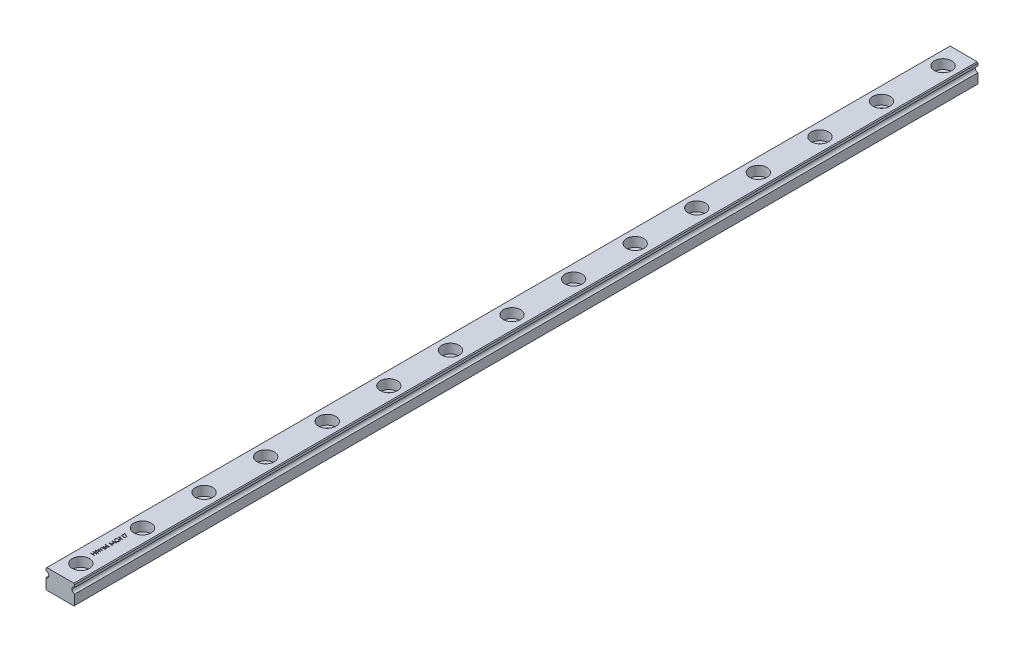
from build123d import *

# Parameters (mm, degrees)
EXTRUDE_1_DEPTH              = 220
HOLE_WIZARD_M2_1_D           = 2.4
HOLE_WIZARD_M2_1_CBORE_D     = 4.2
HOLE_WIZARD_M2_1_CBORE_DEPTH = 2.3
PATTERN_LINEAR_1_COUNT       = 15
PATTERN_LINEAR_1_PITCH       = 15
SKETCH_6_W                   = 1
SKETCH_6_H                   = 0.089743589
CUT_EXTRUDE_1_DEPTH          = 0.1


with BuildPart() as part:
    # 草图1 → 凸台-拉伸1 (new body)
    with BuildSketch(Plane.XY):
        with BuildLine():
            Line((0.2, 0), (0.8, 0))
            Line((0.8, 0), (3.3, 0))
            Line((3.3, 0), (3.5, 0.2))
            Line((3.5, 0.2), (3.5, 2.6))
            ThreePointArc((3.5, 2.6), (2.8, 3.3), (3.5, 4))
            Line((3.5, 4), (3.5, 4.6))
            Line((3.5, 4.6), (3.3, 4.8))
            Line((3.3, 4.8), (-3.3, 4.8))
            Line((-3.3, 4.8), (-3.5, 4.6))
            Line((-3.5, 4.6), (-3.5, 4))
            ThreePointArc((-3.5, 4), (-2.8, 3.3), (-3.5, 2.6))
            Line((-3.5, 2.6), (-3.5, 0.2))
            Line((-3.5, 0.2), (-3.3, 0))
            Line((-3.3, 0), (0.2, 0))
        make_face()
    extrude(amount=-EXTRUDE_1_DEPTH)

    # M2 六角凹头螺钉的柱形沉头孔1 (through all)
    with Locations(Plane(origin=(1.647961524, 4.8, 19.977127426), x_dir=(-1, 0, 0), z_dir=(0, 1, 0))):
        with Locations((1.647961524, -24.977127426)):
            hole_wizard_m2_1 = CounterBoreHole(HOLE_WIZARD_M2_1_D / 2, HOLE_WIZARD_M2_1_CBORE_D / 2, HOLE_WIZARD_M2_1_CBORE_DEPTH)

    # 阵列(线性)1: M2 六角凹头螺钉的柱形沉头孔1 ×15
    with Locations(*[(0, 0, -i * PATTERN_LINEAR_1_PITCH) for i in range(1, PATTERN_LINEAR_1_COUNT)]):
        add(hole_wizard_m2_1, mode=Mode.SUBTRACT)

    # 草图6 → 切除-拉伸1 (cut)
    with BuildSketch(Plane(origin=(0, 4.8, 0), x_dir=(1, 0, 0), z_dir=(0, 1, 0))):
        Polygon((-1, 8.326923077), (-1, 8.416666667), (-0.58974359, 8.416666667), (-0.58974359, 8.929487179), (-1, 8.929487179), (-1, 9.019230769), (0, 9.019230769), (0, 8.929487179), (-0.487179487, 8.929487179), (-0.487179487, 8.416666667), (0, 8.416666667), (0, 8.326923077), align=None)
        with Locations((-0.5, 9.32051282)):
            Rectangle(SKETCH_6_W, SKETCH_6_H)
        Polygon((-1, 9.519230769), (-1, 9.611979167), (-0.266626603, 9.807692308), (-1, 10.098758013), (-1, 10.111778846), (-0.271634615, 10.397435897), (-1, 10.594150641), (-1, 10.685897436), (0, 10.416266026), (0, 10.403445513), (-0.764823718, 10.102564103), (0, 9.798076923), (0, 9.78525641), align=None)
        with Locations((-0.5, 10.961538462)):
            Rectangle(SKETCH_6_W, SKETCH_6_H)
        Polygon((0, 11.224358974), (-1, 11.224358974), (-1, 11.243189103), (-0.212940705, 11.903846154), (-1, 11.903846154), (-1, 11.993589744), (0, 11.993589744), (0, 11.973157051), (-0.78525641, 11.314102564), (0, 11.314102564), align=None)
        Polygon((0, 12.583333333), (-1, 12.715344551), (-1, 12.728165064), (-0.179487179, 13.141025641), (-1, 13.552884615), (-1, 13.565905449), (0, 13.698717949), (0, 13.608573718), (-0.719551282, 13.512820513), (0, 13.151842949), (0, 13.131610577), (-0.721153846, 12.769230769), (0, 12.673677885), align=None)
        with BuildLine():
            Line((-0.829326923, 14.83974359), (-0.756410256, 14.762820513))
            add(Edge.make_bspline(
                [(-0.756410256, 14.762820513), (-0.769509177, 14.748903633), (-0.795394667, 14.721401728), (-0.828926878, 14.676487459), (-0.857936286, 14.629814358), (-0.881363598, 14.581306958), (-0.899741215, 14.532237244), (-0.913100062, 14.483448972), (-0.921560108, 14.435258029), (-0.922576227, 14.403211086), (-0.923076923, 14.387419872)],
                knots=[0, 0, 0, 0, 1.089067066, 2.152164705, 3.18986567, 4.218445106, 5.218487318, 6.173592265, 7.100032889, 8, 8, 8, 8], degree=3))
            add(Edge.make_bspline(
                [(-0.923076923, 14.387419872), (-0.92295875, 14.377729958), (-0.92272271, 14.35837526), (-0.919710077, 14.329626133), (-0.915377259, 14.301178523), (-0.909108151, 14.27308613), (-0.901162706, 14.245294334), (-0.891224001, 14.217899794), (-0.879636792, 14.190851402), (-0.8662475, 14.164403968), (-0.851539021, 14.138763759), (-0.835239261, 14.11454776), (-0.817871683, 14.091600199), (-0.798997604, 14.070357569), (-0.778802089, 14.050678565), (-0.757648841, 14.032201222), (-0.735121964, 14.015269914), (-0.711314092, 14.000188302), (-0.686779105, 13.98656899), (-0.661725084, 13.97479979), (-0.636384612, 13.964568374), (-0.61056688, 13.956775814), (-0.584538056, 13.950175564), (-0.558161739, 13.945580925), (-0.531369048, 13.942981978), (-0.513426849, 13.942533266), (-0.504407051, 13.942307692)],
                knots=[0, 0, 0, 0, 1.028150113, 2.053633673, 3.06513288, 4.081487945, 5.106702018, 6.131327874, 7.172780699, 8.228344599, 9.276313556, 10.308389736, 11.324843658, 12.329040066, 13.321460474, 14.316307835, 15.308626991, 16.309440696, 17.305625405, 18.28535951, 19.246194545, 20.203493668, 21.145557131, 22.095268976, 23.042464743, 24, 24, 24, 24], degree=3))
            add(Edge.make_bspline(
                [(-0.504407051, 13.942307692), (-0.495186862, 13.942523748), (-0.476771662, 13.94295527), (-0.449286976, 13.945713326), (-0.422213666, 13.950843386), (-0.395509151, 13.957646743), (-0.369120284, 13.966296079), (-0.343074603, 13.976922511), (-0.31737464, 13.989581406), (-0.292275521, 14.004201769), (-0.267846912, 14.020347331), (-0.244643347, 14.038104812), (-0.222934856, 14.057504108), (-0.202404358, 14.078189521), (-0.183181421, 14.10034952), (-0.165497749, 14.1241991), (-0.149079898, 14.149404412), (-0.134108231, 14.175976638), (-0.120734697, 14.203634918), (-0.108842066, 14.231993898), (-0.099047993, 14.261144727), (-0.091065671, 14.29093406), (-0.084522731, 14.321326426), (-0.08031345, 14.352476083), (-0.077258927, 14.384154), (-0.077035593, 14.405507895), (-0.076923077, 14.416266026)],
                knots=[0, 0, 0, 0, 0.935915162, 1.869274651, 2.799799983, 3.730201895, 4.664668062, 5.616159355, 6.583070886, 7.570012957, 8.562524459, 9.553461134, 10.53281078, 11.515274572, 12.509912756, 13.507571325, 14.526460018, 15.561318395, 16.601025881, 17.643204557, 18.680545676, 19.719612342, 20.772381578, 21.833430283, 22.908478249, 24, 24, 24, 24], degree=3))
            add(Edge.make_bspline(
                [(-0.076923077, 14.416266026), (-0.077193986, 14.429231321), (-0.077725961, 14.454690783), (-0.081870496, 14.492114732), (-0.088335201, 14.528061194), (-0.097832073, 14.562413148), (-0.109852773, 14.595295261), (-0.124718081, 14.626586257), (-0.142271591, 14.656372541), (-0.162157847, 14.684525187), (-0.184314551, 14.710374908), (-0.208010182, 14.733901216), (-0.233551734, 14.754295108), (-0.260558548, 14.77216577), (-0.28928895, 14.786936411), (-0.319583111, 14.799063805), (-0.351459775, 14.808358792), (-0.373485924, 14.812174532), (-0.384615385, 14.814102564)],
                knots=[0, 0, 0, 0, 1.130199668, 2.219330667, 3.279027493, 4.311506524, 5.322739849, 6.327972234, 7.327472899, 8.33386792, 9.329086447, 10.29244429, 11.240784345, 12.174119183, 13.111530729, 14.052100829, 15.015757696, 16, 16, 16, 16], degree=3))
            Line((-0.384615385, 14.814102564), (-0.384615385, 14.480769231))
            Line((-0.384615385, 14.480769231), (-0.487179487, 14.480769231))
            Line((-0.487179487, 14.480769231), (-0.487179487, 14.903846154))
            add(Edge.make_bspline(
                [(-0.487179487, 14.903846154), (-0.468063062, 14.903358769), (-0.430648764, 14.902404868), (-0.37608583, 14.895713749), (-0.32455106, 14.884909031), (-0.275990182, 14.870148942), (-0.230472013, 14.851041719), (-0.187950337, 14.827792425), (-0.148699857, 14.800028962), (-0.112400142, 14.768740264), (-0.080020367, 14.733625991), (-0.051561527, 14.695634957), (-0.027589351, 14.654704394), (-0.008086305, 14.610873021), (0.007134836, 14.564284325), (0.017926715, 14.514830502), (0.024392419, 14.462578617), (0.025218528, 14.426768137), (0.025641026, 14.408453526)],
                knots=[0, 0, 0, 0, 1.140356446, 2.231883559, 3.274166699, 4.278491846, 5.25512956, 6.21435461, 7.1637429, 8.11826594, 9.068280886, 10.0076534, 10.945064095, 11.891975133, 12.864533718, 13.863980011, 14.907571808, 16, 16, 16, 16], degree=3))
            add(Edge.make_bspline(
                [(0.025641026, 14.408453526), (0.02547842, 14.397164916), (0.025157708, 14.374900138), (0.022878466, 14.342017016), (0.01936973, 14.310040553), (0.014071123, 14.278975407), (0.007581222, 14.24870731), (-0.000729269, 14.219387428), (-0.010348898, 14.190904073), (-0.021290519, 14.16321322), (-0.033968135, 14.136566207), (-0.048056603, 14.110844345), (-0.063483278, 14.085905452), (-0.080514948, 14.061919405), (-0.099024222, 14.038761227), (-0.119048199, 14.016580243), (-0.140525662, 13.995252278), (-0.155776807, 13.981892146), (-0.163461538, 13.975160256)],
                knots=[0, 0, 0, 0, 1.107784379, 2.184907829, 3.233506516, 4.263428166, 5.276301166, 6.270063455, 7.25232949, 8.225834625, 9.190232166, 10.146266622, 11.1027726, 12.066435141, 13.031522626, 14.010570082, 14.99756817, 16, 16, 16, 16], degree=3))
            add(Edge.make_bspline(
                [(-0.163461538, 13.975160256), (-0.175653154, 13.965392847), (-0.199834016, 13.946020158), (-0.238576857, 13.921083542), (-0.278691674, 13.899825998), (-0.320290139, 13.882578049), (-0.363333343, 13.869110024), (-0.407766283, 13.859451095), (-0.453646178, 13.853791869), (-0.484693396, 13.852976573), (-0.500400641, 13.852564103)],
                knots=[0, 0, 0, 0, 1.023165419, 2.029347347, 3.013907458, 3.994755782, 4.975994455, 5.96558838, 6.970761222, 8, 8, 8, 8], degree=3))
            add(Edge.make_bspline(
                [(-0.500400641, 13.852564103), (-0.512162428, 13.852716171), (-0.535536515, 13.853018374), (-0.570238603, 13.856682808), (-0.604324516, 13.861940354), (-0.637766384, 13.86966809), (-0.670586575, 13.879409857), (-0.702800197, 13.89156808), (-0.734426755, 13.905723445), (-0.765246694, 13.92217765), (-0.794858013, 13.940483004), (-0.823115804, 13.960370906), (-0.849562095, 13.981994816), (-0.874258149, 14.0054177), (-0.897569993, 14.030167394), (-0.919010679, 14.05676348), (-0.938915717, 14.084803005), (-0.956902635, 14.11450333), (-0.973064879, 14.145395796), (-0.987232901, 14.177413249), (-0.998942507, 14.210544055), (-1.008877849, 14.244540499), (-1.016225039, 14.279659779), (-1.02155325, 14.315647077), (-1.025199136, 14.352689966), (-1.025492352, 14.377728831), (-1.025641026, 14.390424679)],
                knots=[0, 0, 0, 0, 1.00895651, 2.005089799, 2.991467152, 3.967318338, 4.948153826, 5.927364234, 6.919980553, 7.91976625, 8.923240147, 9.905815003, 10.88314567, 11.851989312, 12.825009789, 13.798721852, 14.781296708, 15.773896486, 16.776076962, 17.771600213, 18.775744723, 19.78957137, 20.808953803, 21.851964491, 22.910847925, 24, 24, 24, 24], degree=3))
            add(Edge.make_bspline(
                [(-1.025641026, 14.390424679), (-1.025475457, 14.400778463), (-1.025147153, 14.4213088), (-1.022871539, 14.451859009), (-1.019264716, 14.481937014), (-1.014342777, 14.511587411), (-1.007638865, 14.54070923), (-0.999616498, 14.569385431), (-0.990275977, 14.597657584), (-0.979136307, 14.625437084), (-0.966492414, 14.652910717), (-0.952260008, 14.680231243), (-0.936195721, 14.707305313), (-0.918251853, 14.73417988), (-0.898736591, 14.76102441), (-0.877091784, 14.787414308), (-0.854170997, 14.813986578), (-0.837690373, 14.831072811), (-0.829326923, 14.83974359)],
                knots=[0, 0, 0, 0, 0.985871117, 1.954866573, 2.915460327, 3.869826059, 4.81536089, 5.759505086, 6.70452669, 7.649098992, 8.607881297, 9.583363685, 10.581137262, 11.603961102, 12.659522466, 13.73993555, 14.853081303, 16, 16, 16, 16], degree=3))
        make_face()
        Polygon((0, 15.108974359), (-1, 15.108974359), (-1, 15.127804487), (-0.212940705, 15.788461538), (-1, 15.788461538), (-1, 15.878205128), (0, 15.878205128), (0, 15.857772436), (-0.78525641, 15.198717949), (0, 15.198717949), align=None)
        Polygon((-1, 16.108974359), (-1, 16.724358974), (0.025641026, 16.198717949), (-0.017027244, 16.12119391), (-0.897435897, 16.572516026), (-0.897435897, 16.108974359), align=None)
    extrude(amount=-CUT_EXTRUDE_1_DEPTH, mode=Mode.SUBTRACT)


solid = part.part
